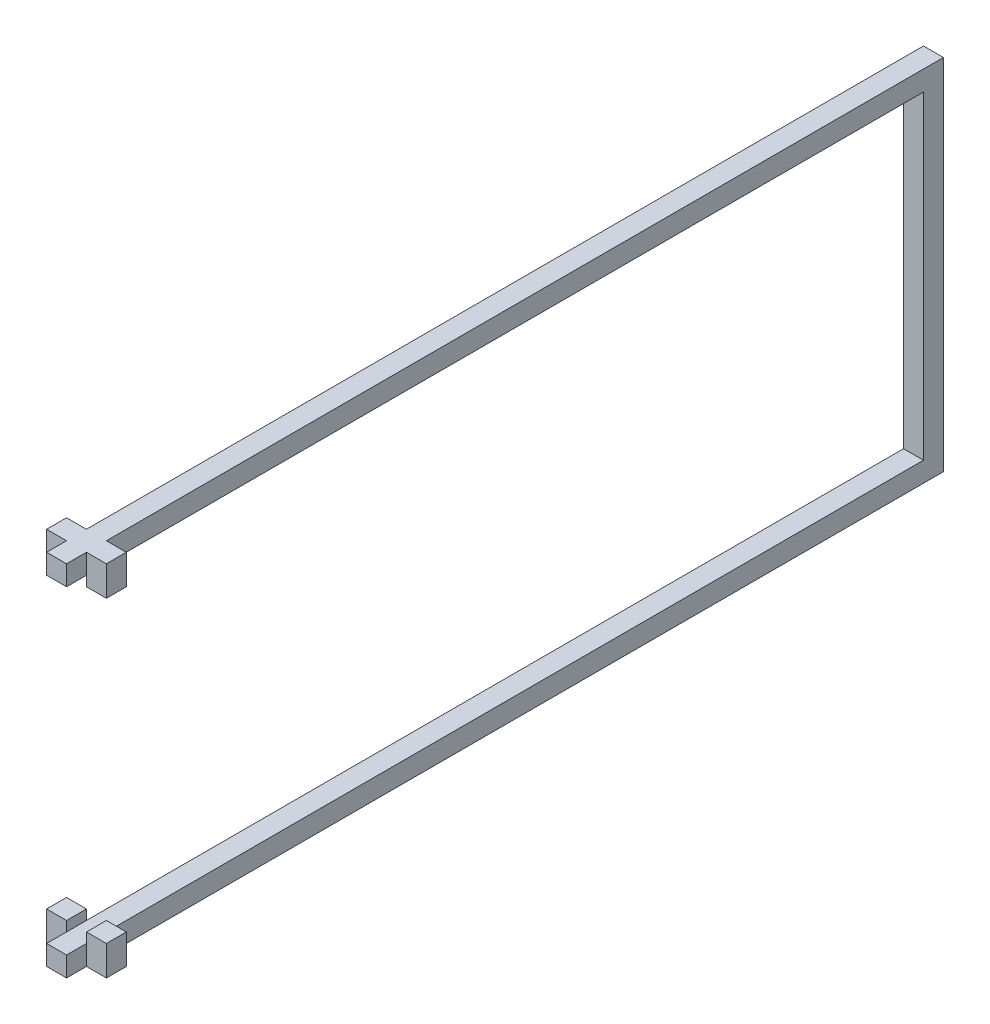
from build123d import *

# Parameters (mm, degrees)
SKETCH1_W           = 2.54
SKETCH1_H           = 2.54
BOSS_EXTRUDE1_DEPTH = 111.76
SKETCH2_W           = 2.54
SKETCH2_H           = 2.54
BOSS_EXTRUDE2_DEPTH = 40.64
SKETCH3_W           = 2.54
SKETCH3_H           = 2.54
BOSS_EXTRUDE3_DEPTH = 111.76
SKETCH5_W           = 2.54
SKETCH5_H           = 2.54
BOSS_EXTRUDE4_DEPTH = 2.54
SKETCH6_W           = 2.54
SKETCH6_H           = 2.54
BOSS_EXTRUDE5_DEPTH = 2.54
SKETCH7_W           = 2.54
SKETCH7_H           = 2.54
BOSS_EXTRUDE6_DEPTH = 1.27


with BuildPart() as part:
    # Sketch1 → Boss-Extrude1 (new body)
    with BuildSketch(Plane.XY):
        with Locations((-1.27, 1.27)):
            Rectangle(SKETCH1_W, SKETCH1_H)
    extrude(amount=BOSS_EXTRUDE1_DEPTH)

    # Sketch2 → Boss-Extrude2 (add)
    with BuildSketch(Plane.XZ):
        with Locations((-1.27, 1.27)):
            Rectangle(SKETCH2_W, SKETCH2_H)
    extrude(amount=BOSS_EXTRUDE2_DEPTH)

    # Sketch3 → Boss-Extrude3 (add)
    with BuildSketch(Plane(origin=(0, 0, 0), x_dir=(-1, 0, 0), z_dir=(0, 0, -1))):
        with Locations((1.27, -41.91)):
            Rectangle(SKETCH3_W, SKETCH3_H)
    extrude(amount=-BOSS_EXTRUDE3_DEPTH)

    # Sketch5 → Boss-Extrude4 (add)
    with BuildSketch(Plane.ZY.offset(2.54)):
        with Locations((107.95, 1.27)):
            Rectangle(SKETCH5_W, SKETCH5_H)
    boss_extrude4 = extrude(amount=BOSS_EXTRUDE4_DEPTH)

    # Sketch6 → Boss-Extrude5 (add)
    with BuildSketch(Plane(origin=(0, 0, 0), x_dir=(0, 0, -1), z_dir=(1, 0, 0))):
        with Locations((-107.95, 1.27)):
            Rectangle(SKETCH6_W, SKETCH6_H)
    boss_extrude5 = extrude(amount=BOSS_EXTRUDE5_DEPTH)

    # Sketch7 → Boss-Extrude6 (add)
    with BuildSketch(Plane(origin=(0, 0, 0), x_dir=(-1, 0, 0), z_dir=(0, -1, 0))):
        with Locations((3.81, -107.95)):
            Rectangle(SKETCH7_W, SKETCH7_H)
        with Locations((-1.27, -107.95)):
            Rectangle(SKETCH7_W, SKETCH7_H)
    boss_extrude6 = extrude(amount=BOSS_EXTRUDE6_DEPTH)

    # Mirror1: Boss-Extrude4, Boss-Extrude5, Boss-Extrude6 across plane
    add(boss_extrude4.mirror(Plane(origin=(0, -20.32, 0), x_dir=(0, 0, 1), z_dir=(0, -1, 0))))
    add(boss_extrude5.mirror(Plane(origin=(0, -20.32, 0), x_dir=(0, 0, 1), z_dir=(0, -1, 0))))
    add(boss_extrude6.mirror(Plane(origin=(0, -20.32, 0), x_dir=(0, 0, 1), z_dir=(0, -1, 0))))


solid = part.part
